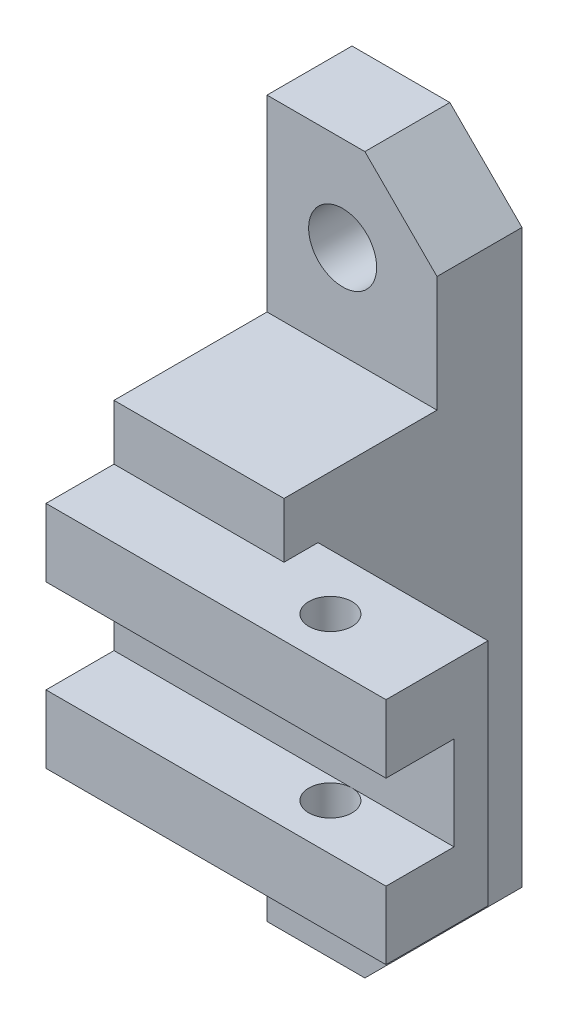
from build123d import *

# Parameters (mm, degrees)
SKETCH1_R               = 2
BOSS_EXTRUDE1_DEPTH     = 5
SKETCH2_W               = 10
SKETCH2_H               = 20
BOSS_EXTRUDE2_DEPTH     = 9
SKETCH3_W               = 20
SKETCH3_H               = 4
BOSS_EXTRUDE3_DEPTH     = 4
SKETCH4_W               = 10
SKETCH4_H               = 13.5
BOSS_EXTRUDE4_DEPTH     = 2
CUT_EXTRUDE1_DEPTH      = 46.397604562
CUT_EXTRUDE1_DEPTH_BACK = 46.397604562
SKETCH5_R               = 1.27


with BuildPart() as part:
    # Sketch1 → Boss-Extrude1 (new body)
    with BuildSketch(Plane.XY):
        Polygon((16.807359313, 21.05), (11.05, 21.05), (11.05, -21.05), (16.807359313, -21.05), (21.05, -16.807359313), (21.05, 16.807359313), align=None)
        with Locations((15.5, -15.5)):
            Circle(SKETCH1_R, mode=Mode.SUBTRACT)
        with Locations((15.5, 15.5)):
            Circle(SKETCH1_R, mode=Mode.SUBTRACT)
    extrude(amount=BOSS_EXTRUDE1_DEPTH)

    # Sketch2 → Boss-Extrude2 (add)
    with BuildSketch(Plane.XY.offset(5)):
        with Locations((16.05, 0)):
            Rectangle(SKETCH2_W, SKETCH2_H)
    extrude(amount=BOSS_EXTRUDE2_DEPTH)

    # Sketch3 → Boss-Extrude3 (add)
    with BuildSketch(Plane.XY.offset(14)):
        with Locations((21.05, 4.75)):
            Rectangle(SKETCH3_W, SKETCH3_H)
        with Locations((21.05, -4.75)):
            Rectangle(SKETCH3_W, SKETCH3_H)
    extrude(amount=BOSS_EXTRUDE3_DEPTH)

    # Sketch4 → Boss-Extrude4 (add)
    with BuildSketch(Plane(origin=(0, 0, 14), x_dir=(-1, 0, 0), z_dir=(0, 0, -1))):
        with Locations((-26.05, 0)):
            Rectangle(SKETCH4_W, SKETCH4_H)
    extrude(amount=BOSS_EXTRUDE4_DEPTH)

    # Sketch5 → Cut-Extrude1 (cut, two sides: drawn at the far end of the back side and taken through both)
    with BuildSketch(Plane.XZ.offset(6.75).offset(-CUT_EXTRUDE1_DEPTH_BACK)):
        with Locations(Location((25.05, 15.27, 0), (0, 0, 270))):
            Circle(SKETCH5_R)
    extrude(amount=CUT_EXTRUDE1_DEPTH + CUT_EXTRUDE1_DEPTH_BACK, mode=Mode.SUBTRACT)


solid = part.part
